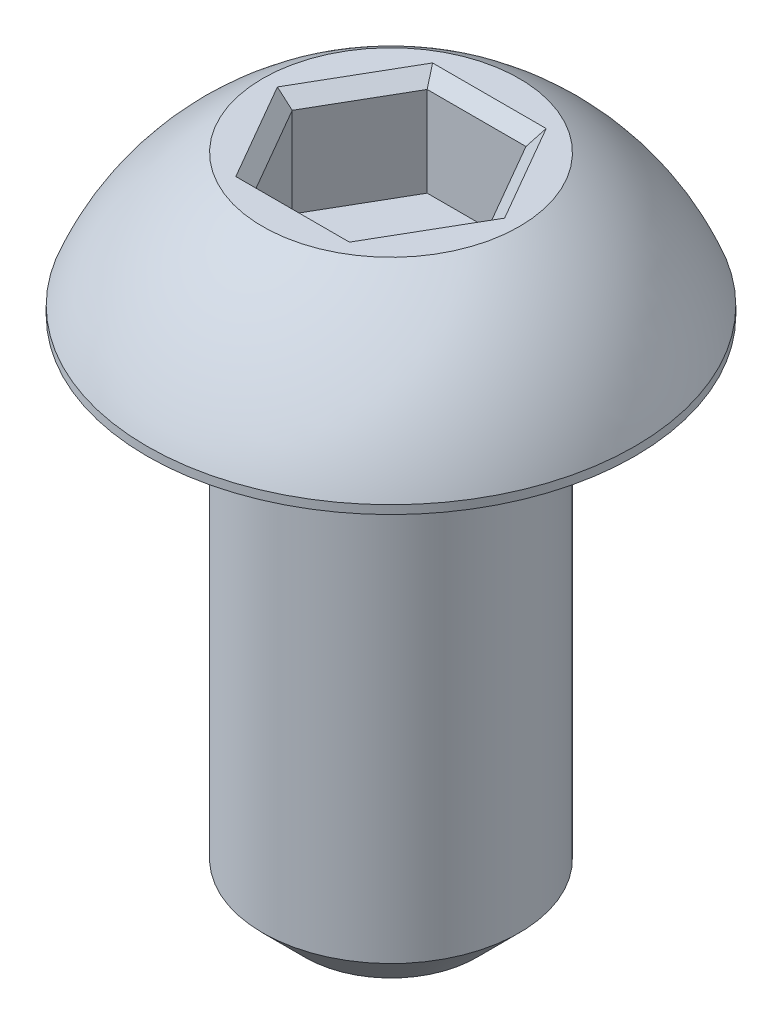
from build123d import *

# Parameters (mm, degrees)
ENL_V_MAT_EXTRU_1_DEPTH = 1.2
CHANFREIN1_SIZE         = 0.15


with BuildPart() as part:
    # Esquisse1 → Révolution1 (revolve)
    with BuildSketch(Plane.XY, mode=Mode.PRIVATE) as r_volution1_sk:
        with BuildLine():
            Line((1.5, -5.5), (1, -6))
            Line((1, -6), (0, -6))
            Line((0, -6), (0, 1.65))
            Line((0, 1.65), (1.5, 1.65))
            ThreePointArc((1.5, 1.65), (2.308949978, 0.99166611), (2.85, 0.1))
            Line((2.85, 0.1), (2.85, 0))
            Line((2.85, 0), (1.5, 0))
            Line((1.5, 0), (1.5, -5.5))
        make_face()
    revolve(r_volution1_sk.sketch.rotate(Axis((0, 6.972972973, 0), (0, -1, 0)), 90), axis=Axis((0, 6.972972973, 0), (0, -1, 0)))

    # Esquisse2 → Enlèv. mat.-Extru.1 (cut)
    with BuildSketch(Plane(origin=(0, 1.65, 0), x_dir=(1, 0, 0), z_dir=(0, 1, 0))):
        Polygon((-1.154700538, 0), (-0.577350269, -1), (0.577350269, -1), (1.154700538, 0), (0.577350269, 1), (-0.577350269, 1), align=None)
    extrude(amount=-ENL_V_MAT_EXTRU_1_DEPTH, mode=Mode.SUBTRACT)

    # Chanfrein1
    chanfrein1_edges = [part.edges().sort_by_distance(p)[0] for p in [
        (-0.866025404, 1.65, -0.5),
        (-0.866025404, 1.65, 0.5),
        (0, 1.65, 1),
        (0.866025404, 1.65, 0.5),
        (0.866025404, 1.65, -0.5),
        (0, 1.65, -1),
    ]]
    chamfer(chanfrein1_edges, length=CHANFREIN1_SIZE)


solid = part.part
